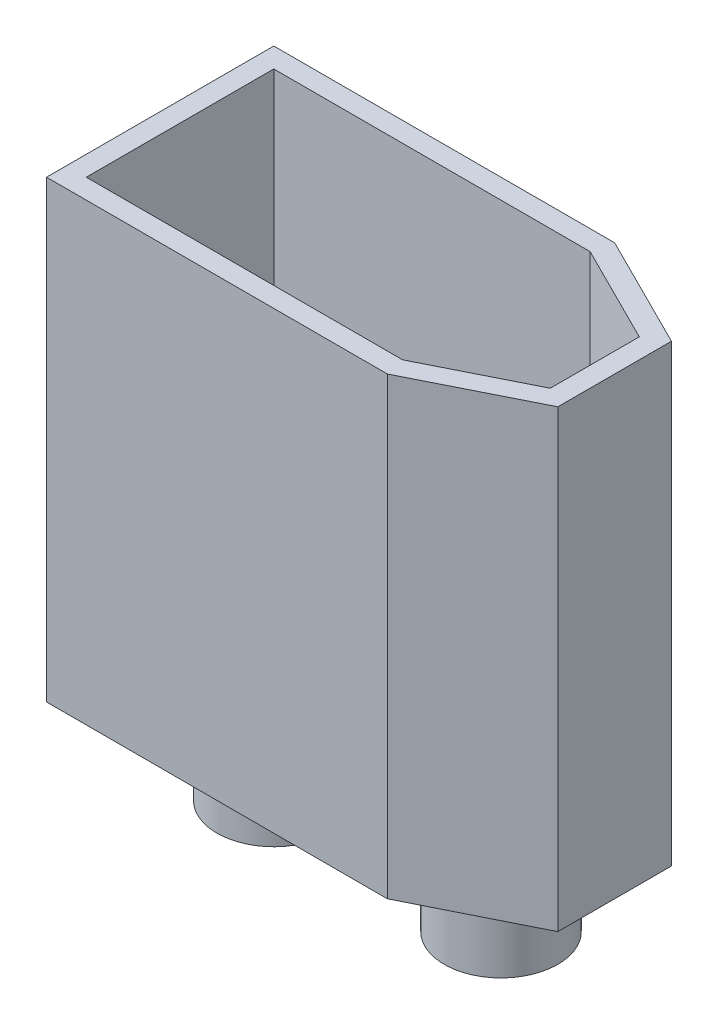
from build123d import *

# Parameters (mm, degrees)
SALIENTE_EXTRUIR1_DEPTH   = 16
CORTAR_EXTRUIR1_DEPTH     = 15
CROQUIS3_R                = 2
SALIENTE_EXTRUIR2_DEPTH   = 3
SALIENTE_EXTRUIR2_2_DEPTH = 3


with BuildPart() as part:
    # Croquis1 → Saliente-Extruir1 (new body)
    with BuildSketch(Plane(origin=(0, 0, 0), x_dir=(1, 0, 0), z_dir=(0, 1, 0))):
        Polygon((0, 0), (0, 8), (12, 8), (16, 6), (16, 2), (12, 0), align=None)
    extrude(amount=SALIENTE_EXTRUIR1_DEPTH)

    # Croquis2 → Cortar-Extruir1 (cut)
    with BuildSketch(Plane(origin=(0, 16, 0), x_dir=(1, 0, 0), z_dir=(0, 1, 0))):
        Polygon((11.834752416, 0.7), (15.3, 2.432623792), (15.3, 5.567376208), (11.834752416, 7.3), (0.7, 7.3), (0.7, 0.7), align=None)
    extrude(amount=-CORTAR_EXTRUIR1_DEPTH, mode=Mode.SUBTRACT)


with BuildPart() as body_2:
    # Croquis3 → Saliente-Extruir2 (new body)
    with BuildSketch(Plane.XZ):
        with Locations(Location((4, -4, 0), (0, 0, 270))):
            Circle(CROQUIS3_R)
    extrude(amount=SALIENTE_EXTRUIR2_DEPTH)


with BuildPart() as body_3:
    # Croquis3 → Saliente-Extruir2 2 (new body)
    with BuildSketch(Plane.XZ):
        with Locations(Location((12, -4, 0), (0, 0, 270))):
            Circle(CROQUIS3_R)
    extrude(amount=SALIENTE_EXTRUIR2_2_DEPTH)


solid = Compound([part.part, body_2.part, body_3.part])
